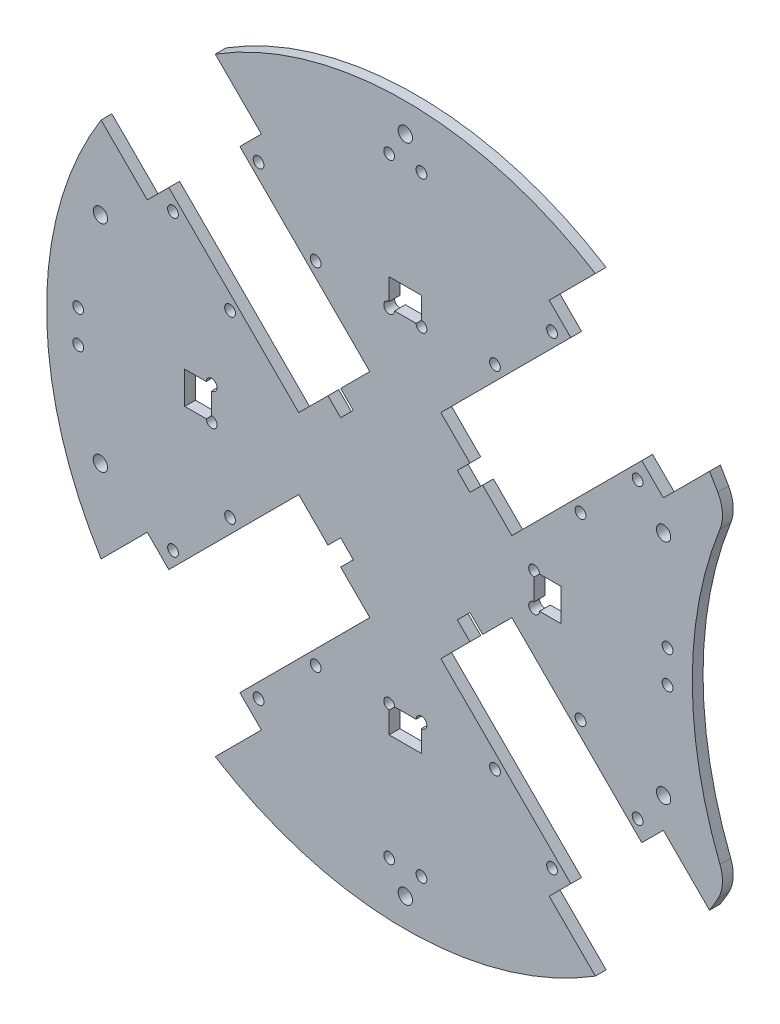
from build123d import *

# Parameters (mm, degrees)
CROQUIS1_R              = 100
SALIENTE_EXTRUIR1_DEPTH = 3
CROQUIS3_R              = 110
CORTAR_EXTRUIR1_DEPTH   = 3
REDONDEO1_R             = 10
CORTAR_EXTRUIR2_DEPTH   = 10
CORTAR_EXTRUIR3_DEPTH   = 10
CROQUIS8_R              = 1.5
CROQUIS8_R_2            = 1.502317269
CROQUIS8_R_3            = 2
CORTAR_EXTRUIR4_DEPTH   = 10
CROQUIS9_R              = 1.5
CROQUIS9_W              = 4.5
CROQUIS9_H              = 7.5
CROQUIS9_W_2            = 7.5
CROQUIS9_H_2            = 4.5
CORTAR_EXTRUIR5_DEPTH   = 10
CORTAR_EXTRUIR6_DEPTH   = 3


with BuildPart() as part:
    # Croquis1 → Saliente-Extruir1 (new body)
    with BuildSketch(Plane.XY):
        Circle(CROQUIS1_R)
    extrude(amount=SALIENTE_EXTRUIR1_DEPTH)

    # Croquis3 → Cortar-Extruir1 (cut)
    with BuildSketch(Plane.XY.offset(3)):
        with Locations((190, 0)):
            Circle(CROQUIS3_R)
    extrude(amount=-CORTAR_EXTRUIR1_DEPTH, mode=Mode.SUBTRACT)

    # Redondeo1
    redondeo1_edges = [part.edges().sort_by_distance(p)[0] for p in [
        (89.473684211, -44.659375654, 1.5),
        (89.473684211, 44.659375654, 1.5),
    ]]
    fillet(redondeo1_edges, radius=REDONDEO1_R)

    # Croquis5 → Cortar-Extruir2 (cut)
    with BuildSketch(Plane.XY.offset(3)):
        Polygon((-29.69848481, -9.899494937), (-9.899494937, -29.69848481), (-64.346717088, -84.145706961), (-84.145706961, -64.346717088), align=None)
        Polygon((-9.899494937, 29.69848481), (-29.69848481, 9.899494937), (-84.145706961, 64.346717088), (-64.346717088, 84.145706961), align=None)
        Polygon((29.69848481, 9.899494937), (9.899494937, 29.69848481), (64.346717088, 84.145706961), (84.145706961, 64.346717088), align=None)
        Polygon((9.899494937, -29.69848481), (29.69848481, -9.899494937), (84.145706961, -64.346717088), (64.346717088, -84.145706961), align=None)
    extrude(amount=-CORTAR_EXTRUIR2_DEPTH, mode=Mode.SUBTRACT)

    # Croquis7 → Cortar-Extruir3 (cut)
    with BuildSketch(Plane.XY.offset(3)):
        Polygon((-71.939339828, -40.119534675), (-40.119534675, -71.939339828), (-57.090097423, -88.909902577), (-88.909902577, -57.090097423), align=None)
        Polygon((-40.119534675, 71.939339828), (-71.939339828, 40.119534675), (-88.909902577, 57.090097423), (-57.090097423, 88.909902577), align=None)
        Polygon((71.939339828, 40.119534675), (40.119534675, 71.939339828), (57.090097423, 88.909902577), (88.909902577, 57.090097423), align=None)
        Polygon((40.119534675, -71.939339828), (71.939339828, -40.119534675), (88.909902577, -57.090097423), (57.090097423, -88.909902577), align=None)
        Polygon((-21.566756826, -18.03122292), (-18.03122292, -21.566756826), (-14.495689014, -18.03122292), (-18.03122292, -14.495689014), align=None)
        Polygon((-21.566756826, 18.03122292), (-18.03122292, 14.495689014), (-14.495689014, 18.03122292), (-18.03122292, 21.566756826), align=None)
        Polygon((18.03122292, 21.566756826), (14.495689014, 18.03122292), (18.03122292, 14.495689014), (21.566756826, 18.03122292), align=None)
        Polygon((21.566756826, -18.03122292), (18.03122292, -14.495689014), (14.495689014, -18.03122292), (18.03122292, -21.566756826), align=None)
    extrude(amount=-CORTAR_EXTRUIR3_DEPTH, mode=Mode.SUBTRACT)

    # Croquis8 → Cortar-Extruir4 (cut)
    with BuildSketch(Plane.XY.offset(3)):
        with Locations((-64.762205999, 40.904423202)):
            Circle(CROQUIS8_R)
        with Locations((-48.852303422, 24.994520625)):
            Circle(CROQUIS8_R_2)
        with Locations((-24.994520625, 48.852303422)):
            Circle(CROQUIS8_R)
        with Locations((-40.904423202, 64.762205999)):
            Circle(CROQUIS8_R)
        with Locations((64.762205999, 40.904423202)):
            Circle(CROQUIS8_R)
        with Locations((48.852303422, 24.994520625)):
            Circle(CROQUIS8_R)
        with Locations((24.994520625, 48.852303422)):
            Circle(CROQUIS8_R_2)
        with Locations((40.904423202, 64.762205999)):
            Circle(CROQUIS8_R)
        with Locations((40.904423202, -64.762205999)):
            Circle(CROQUIS8_R)
        with Locations((24.994520625, -48.852303422)):
            Circle(CROQUIS8_R)
        with Locations((48.852303422, -24.994520625)):
            Circle(CROQUIS8_R_2)
        with Locations((64.762205999, -40.904423202)):
            Circle(CROQUIS8_R)
        with Locations((-64.762205999, -40.904423202)):
            Circle(CROQUIS8_R)
        with Locations((-48.852303422, -24.994520625)):
            Circle(CROQUIS8_R)
        with Locations((-24.994520625, -48.852303422)):
            Circle(CROQUIS8_R_2)
        with Locations((-40.904423202, -64.762205999)):
            Circle(CROQUIS8_R)
        with Locations((0, 92)):
            Circle(CROQUIS8_R_3)
        with Locations((0, -92)):
            Circle(CROQUIS8_R_3)
        with Locations((72, 31.694913472)):
            Circle(CROQUIS8_R_3)
        with Locations((72, -31.694913472)):
            Circle(CROQUIS8_R_3)
        with Locations((-85, -30)):
            Circle(CROQUIS8_R_3)
        with Locations((-85, 30)):
            Circle(CROQUIS8_R_3)
    extrude(amount=-CORTAR_EXTRUIR4_DEPTH, mode=Mode.SUBTRACT)

    # Croquis9 → Cortar-Extruir5 (cut)
    with BuildSketch(Plane.XY.offset(3)):
        with Locations((73.1, -4.5)):
            Circle(CROQUIS9_R)
        with Locations((35.9, 4.5)):
            Circle(CROQUIS9_R)
        with Locations((73.1, 4.5)):
            Circle(CROQUIS9_R)
        with Locations((35.9, -4.5)):
            Circle(CROQUIS9_R)
        with Locations((-91.190074744, 4.5)):
            Circle(CROQUIS9_R)
        with Locations((-91.190074744, -4.5)):
            Circle(CROQUIS9_R)
        with Locations((-53.990074744, 4.5)):
            Circle(CROQUIS9_R)
        with Locations((-53.990074744, -4.5)):
            Circle(CROQUIS9_R)
        with Locations((-4.5, 85)):
            Circle(CROQUIS9_R)
        with Locations((4.5, 85)):
            Circle(CROQUIS9_R)
        with Locations((-4.5, 47.8)):
            Circle(CROQUIS9_R)
        with Locations((4.5, 47.8)):
            Circle(CROQUIS9_R)
        with Locations((-4.5, -47.8)):
            Circle(CROQUIS9_R)
        with Locations((4.5, -47.8)):
            Circle(CROQUIS9_R)
        with Locations((4.5, -85)):
            Circle(CROQUIS9_R)
        with Locations((-4.5, -85)):
            Circle(CROQUIS9_R)
        with Locations((39.85, 0)):
            Rectangle(CROQUIS9_W, CROQUIS9_H)
        with Locations((0, -51.75)):
            Rectangle(CROQUIS9_W_2, CROQUIS9_H_2)
        with Locations((-57.940074744, 0)):
            Rectangle(CROQUIS9_W, CROQUIS9_H)
        with Locations((0, 51.75)):
            Rectangle(CROQUIS9_W_2, CROQUIS9_H_2)
    extrude(amount=-CORTAR_EXTRUIR5_DEPTH, mode=Mode.SUBTRACT)

    # Croquis10 → Cortar-Extruir6 (cut)
    with BuildSketch(Plane.XY.offset(3)):
        with BuildLine():
            Line((-4.5, 49.3), (-4.5, 55.3))
            Line((-4.5, 55.3), (4.5, 55.3))
            Line((4.5, 55.3), (4.5, 49.3))
            ThreePointArc((4.5, 49.3), (3.439339828, 48.860660172), (3, 47.8))
            Line((3, 47.8), (-3, 47.8))
            ThreePointArc((-3, 47.8), (-3.439339828, 48.860660172), (-4.5, 49.3))
        make_face()
        with BuildLine():
            Line((43.4, 4.5), (37.4, 4.5))
            ThreePointArc((37.4, 4.5), (36.960660172, 3.439339828), (35.9, 3))
            Line((35.9, 3), (35.9, -3))
            ThreePointArc((35.9, -3), (36.960660172, -3.439339828), (37.4, -4.5))
            Line((37.4, -4.5), (43.4, -4.5))
            Line((43.4, -4.5), (43.4, 4.5))
        make_face()
        with BuildLine():
            ThreePointArc((3, -47.8), (3.439339828, -48.860660172), (4.5, -49.3))
            Line((4.5, -49.3), (4.5, -55.3))
            Line((4.5, -55.3), (-4.5, -55.3))
            Line((-4.5, -55.3), (-4.5, -49.3))
            ThreePointArc((-4.5, -49.3), (-3.439339828, -48.860660172), (-3, -47.8))
            Line((-3, -47.8), (3, -47.8))
        make_face()
        with BuildLine():
            Line((-61.490074744, -4.5), (-55.490074744, -4.5))
            ThreePointArc((-55.490074744, -4.5), (-55.050734915, -3.439339828), (-53.990074744, -3))
            Line((-53.990074744, -3), (-53.990074744, 3))
            ThreePointArc((-53.990074744, 3), (-55.050734915, 3.439339828), (-55.490074744, 4.5))
            Line((-55.490074744, 4.5), (-61.490074744, 4.5))
            Line((-61.490074744, 4.5), (-61.490074744, -4.5))
        make_face()
    extrude(amount=-CORTAR_EXTRUIR6_DEPTH, mode=Mode.SUBTRACT)


solid = part.part
